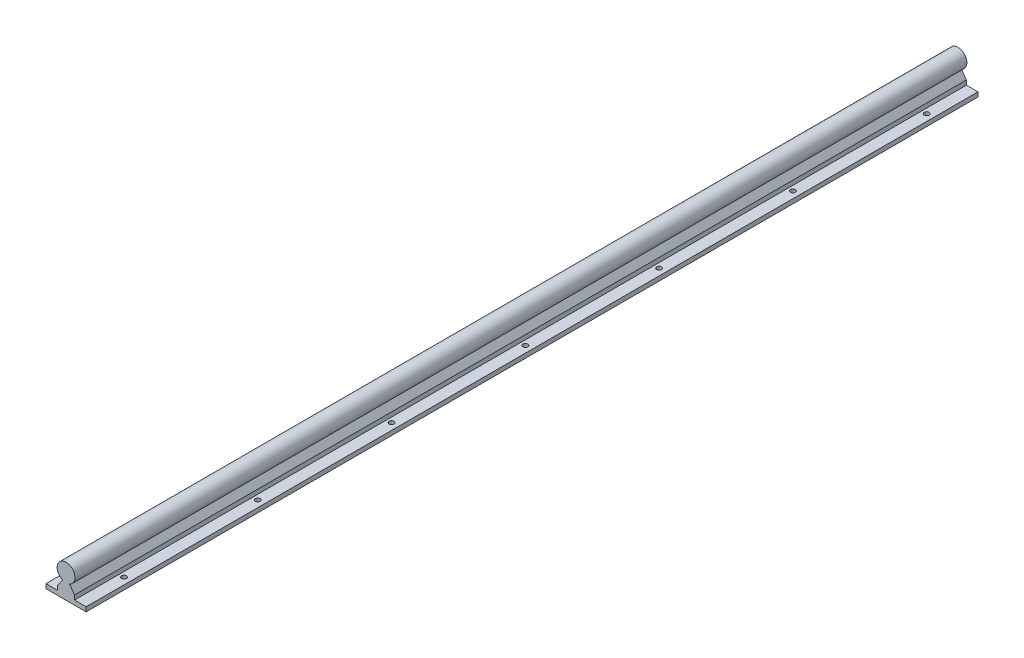
from build123d import *

# Parameters (mm, degrees)
SKETCH_1_R          = 10
EXTRUDE_1_DEPTH     = 1000
SKETCH_2_R          = 2.75
CUT_EXTRUDE_2_DEPTH = 450


with BuildPart() as part:
    # 草图1 → 凸台-拉伸1 (new body)
    with BuildSketch(Plane.XY):
        with Locations((0, 27)):
            Circle(SKETCH_1_R)
        with BuildLine():
            Line((-22.5, 5), (-22.5, 0))
            Line((-22.5, 0), (0, 0))
            Line((0, 0), (0, 17))
            ThreePointArc((0, 17), (-1.870828693, 17.176558648), (-3.67559519, 17.7))
            Line((-3.67559519, 17.7), (-4, 17.7))
            Line((-4, 17.7), (-9.5, 10))
            Line((-9.5, 10), (-9.5, 5))
            Line((-9.5, 5), (-22.5, 5))
        make_face()
        with BuildLine():
            Line((0, 17), (0, 0))
            Line((0, 0), (22.5, 0))
            Line((22.5, 0), (22.5, 5))
            Line((22.5, 5), (9.5, 5))
            Line((9.5, 5), (9.5, 10))
            Line((9.5, 10), (4, 17.7))
            Line((4, 17.7), (3.67559519, 17.7))
            ThreePointArc((3.67559519, 17.7), (1.870828693, 17.176558648), (0, 17))
        make_face()
    extrude(amount=EXTRUDE_1_DEPTH)

    # 草图2 → 切除-拉伸2 (cut)
    with BuildSketch(Plane(origin=(0, 0, 0), x_dir=(1, 0, 0), z_dir=(0, 1, 0))):
        with Locations((15, -500)):
            Circle(SKETCH_2_R)
        with Locations((15, -650)):
            Circle(SKETCH_2_R)
        with Locations(Location((-15, -500, 0), (0, 0, 180))):
            Circle(SKETCH_2_R)
        with Locations(Location((-15, -650, 0), (0, 0, 180))):
            Circle(SKETCH_2_R)
        with Locations((15, -350)):
            Circle(SKETCH_2_R)
        with Locations(Location((-15, -350, 0), (0, 0, 180))):
            Circle(SKETCH_2_R)
        with Locations(Location((-15, -200, 0), (0, 0, 180))):
            Circle(SKETCH_2_R)
        with Locations((15, -200)):
            Circle(SKETCH_2_R)
        with Locations(Location((-15, -50, 0), (0, 0, 180))):
            Circle(SKETCH_2_R)
        with Locations((15, -50)):
            Circle(SKETCH_2_R)
        with Locations(Location((-15, -800, 0), (0, 0, 180))):
            Circle(SKETCH_2_R)
        with Locations((15, -800)):
            Circle(SKETCH_2_R)
        with Locations(Location((-15, -950, 0), (0, 0, 180))):
            Circle(SKETCH_2_R)
        with Locations((15, -950)):
            Circle(SKETCH_2_R)
    extrude(amount=CUT_EXTRUDE_2_DEPTH, mode=Mode.SUBTRACT)


solid = part.part
